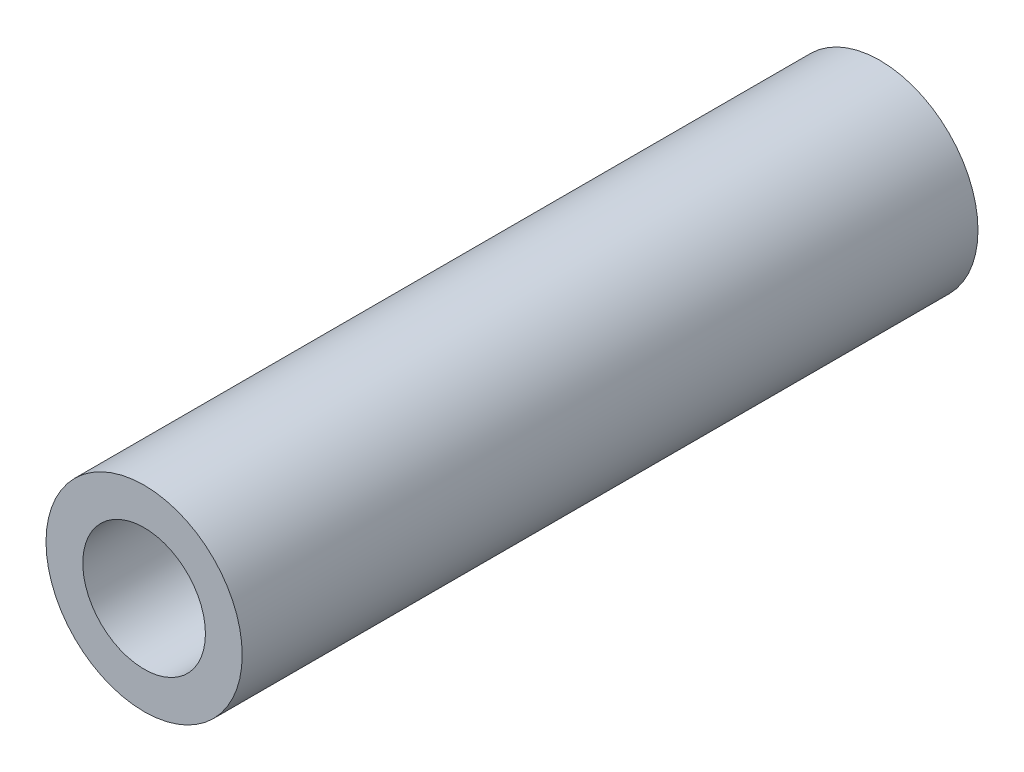
from build123d import *

# Parameters (mm, degrees)
SKETCH_1_R      = 4
SKETCH_1_R_2    = 2.5
EXTRUDE_1_DEPTH = 15


with BuildPart() as part:
    # 草图1 → 凸台-拉伸1 (new, symmetric)
    with BuildSketch(Plane.XY):
        Circle(SKETCH_1_R)
        Circle(SKETCH_1_R_2, mode=Mode.SUBTRACT)
    extrude(amount=EXTRUDE_1_DEPTH, both=True)


solid = part.part
